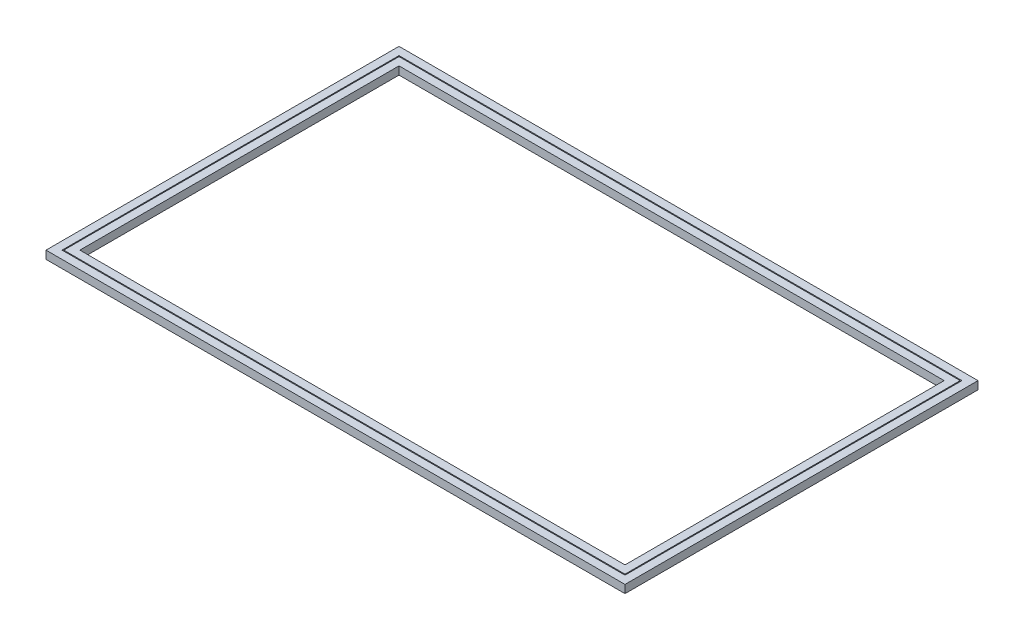
from build123d import *

# Parameters (mm, degrees)
SKETCH6_W             = 629.882620812
SKETCH6_H             = 376.220667898
SKETCH6_W_2           = 611.882620812
SKETCH6_H_2           = 358.220667898
BOSS_EXTRUDE3_DEPTH   = 9
SKETCH6_W_3           = 649.882620812
SKETCH6_H_3           = 396.220667898
SKETCH6_W_4           = 631.882620812
SKETCH6_H_4           = 378.220667898
BOSS_EXTRUDE3_2_DEPTH = 9


with BuildPart() as part:
    # Sketch6 → Boss-Extrude3 (new body)
    with BuildSketch(Plane(origin=(0, 0, 0), x_dir=(1, 0, 0), z_dir=(0, 1, 0))):
        Rectangle(SKETCH6_W, SKETCH6_H)
        Rectangle(SKETCH6_W_2, SKETCH6_H_2, mode=Mode.SUBTRACT)
    extrude(amount=BOSS_EXTRUDE3_DEPTH)


with BuildPart() as body_2:
    # Sketch6 → Boss-Extrude3 2 (new body)
    with BuildSketch(Plane(origin=(0, 0, 0), x_dir=(1, 0, 0), z_dir=(0, 1, 0))):
        Rectangle(SKETCH6_W_3, SKETCH6_H_3)
        Rectangle(SKETCH6_W_4, SKETCH6_H_4, mode=Mode.SUBTRACT)
    extrude(amount=BOSS_EXTRUDE3_2_DEPTH)


solid = Compound([part.part, body_2.part])
